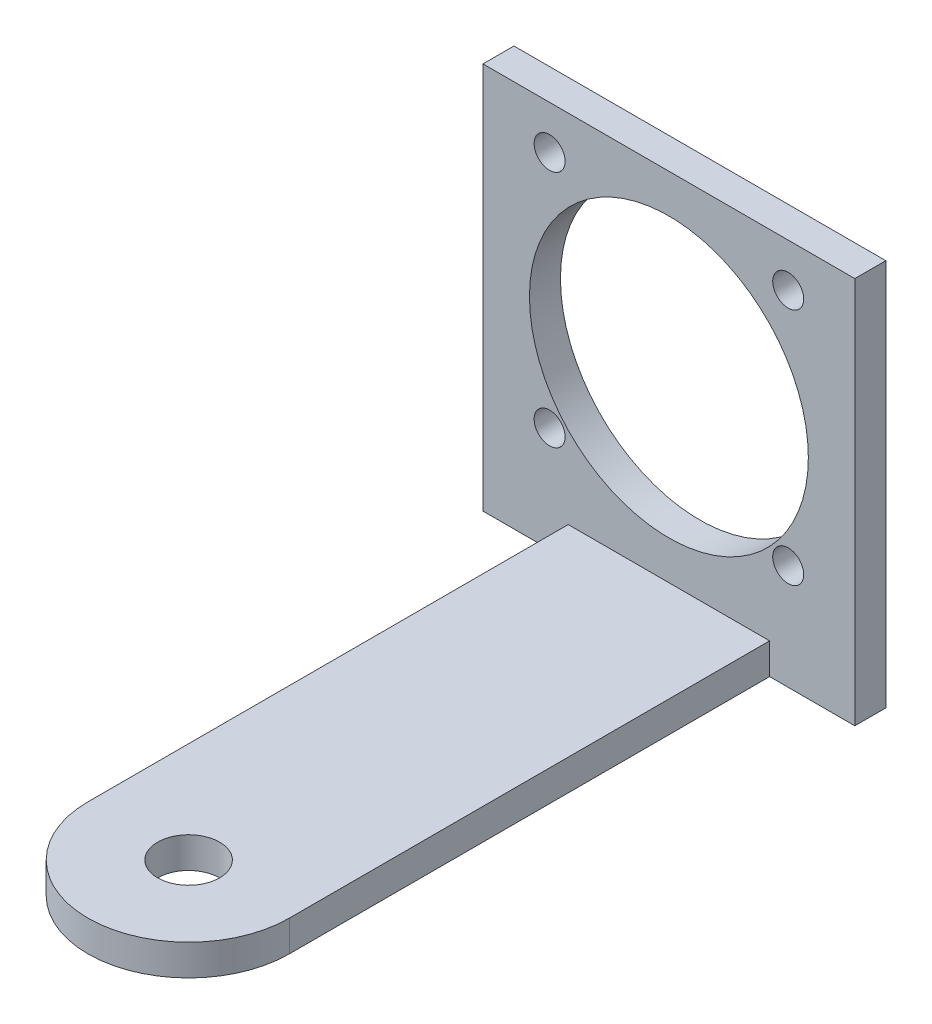
from build123d import *

# Parameters (mm, degrees)
SKETCH_2_R          = 6.5
EXTRUDE_1_DEPTH     = 2
SKETCH_3_R          = 2
CUT_EXTRUDE_2_DEPTH = 10.407443861
EXTRUDE_START       = -2
EXTRUDE_2_DEPTH     = 2
EXTRUDE_3_DEPTH     = 2
SKETCH_22_R         = 9
SKETCH_22_R_2       = 1
CUT_EXTRUDE_4_DEPTH = 2


with BuildPart() as part:
    # 草图2 → 凸台-拉伸1 (new body)
    with BuildSketch(Plane(origin=(0, 0, 0), x_dir=(1, 0, 0), z_dir=(0, 1, 0))):
        with Locations(Location((0, 0, 0), (0, 0, 270))):
            Circle(SKETCH_2_R)
    extrude(amount=EXTRUDE_1_DEPTH)

    # 草图3 → 切除-拉伸2 (cut, through all)
    with BuildSketch(Plane(origin=(0, 2, 0), x_dir=(1, 0, 0), z_dir=(0, 1, 0))):
        with Locations(Location((0, 0, 0), (0, 0, 270))):
            Circle(SKETCH_3_R)
    extrude(amount=-CUT_EXTRUDE_2_DEPTH, mode=Mode.SUBTRACT)

    # 草图4 → 凸台-拉伸2 (add)
    with BuildSketch(Plane(origin=(0, 2, 0), x_dir=(1, 0, 0), z_dir=(0, 1, 0)).offset(EXTRUDE_START)):
        with BuildLine():
            Line((6.5, 0), (6.5, 31))
            Line((6.5, 31), (3.899148682, 31))
            Line((3.899148682, 31), (-4.100851318, 31))
            Line((-4.100851318, 31), (-6.5, 31))
            Line((-6.5, 31), (-6.5, 0))
            ThreePointArc((-6.5, 0), (0, 6.5), (6.5, 0))
        make_face()
    extrude(amount=EXTRUDE_2_DEPTH)

    # 草图21 → 凸台-拉伸3 (add)
    with BuildSketch(Plane(origin=(0, 0, -31), x_dir=(-1, 0, 0), z_dir=(0, 0, -1))):
        Polygon((0, 0), (12, 0), (12, 25), (-12, 25), (-12, 0), align=None)
    extrude(amount=EXTRUDE_3_DEPTH)

    # 草图22 → 切除-拉伸4 (cut)
    with BuildSketch(Plane.XY.offset(-31)):
        with Locations((0, 13.5)):
            Circle(SKETCH_22_R)
        with Locations((7.7, 22.2)):
            Circle(SKETCH_22_R_2)
        with Locations((-7.7, 22.2)):
            Circle(SKETCH_22_R_2)
        with Locations((-7.7, 6.8)):
            Circle(SKETCH_22_R_2)
        with Locations((7.7, 6.8)):
            Circle(SKETCH_22_R_2)
    extrude(amount=-CUT_EXTRUDE_4_DEPTH, mode=Mode.SUBTRACT)


solid = part.part
